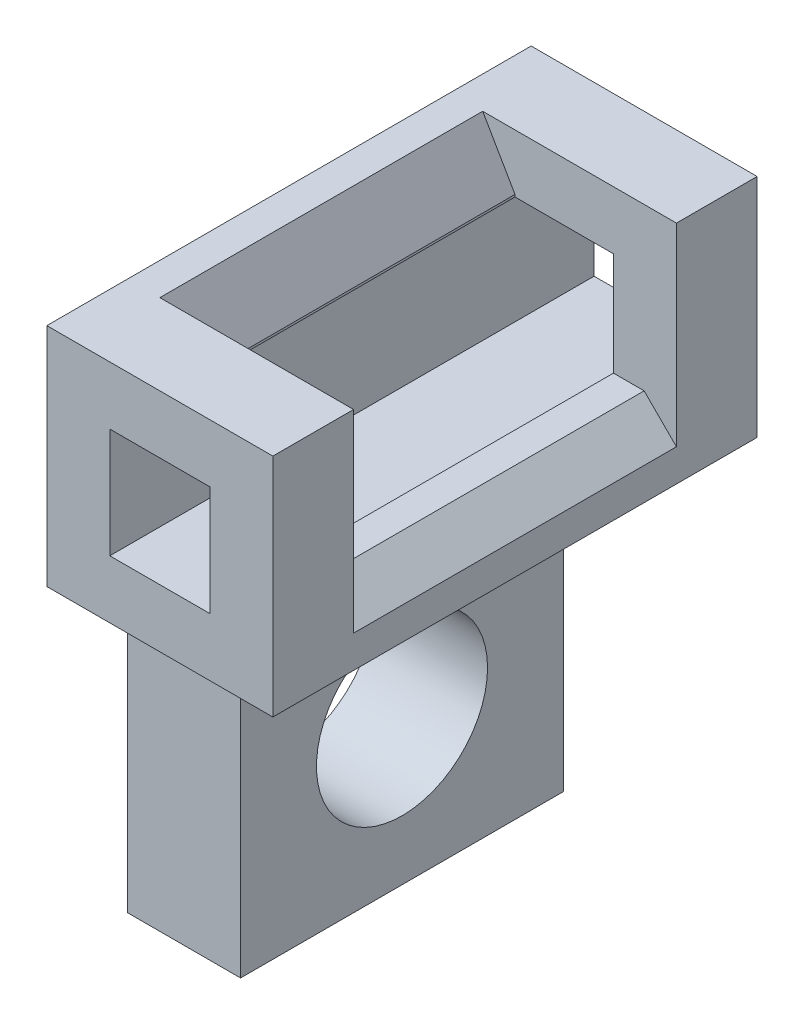
from build123d import *

# Parameters (mm, degrees)
SKIZZE1_W                       = 7
SKIZZE1_H                       = 7
AUFSATZ_LINEAR_AUSTRAGEN1_DEPTH = 15
SKIZZE2_W                       = 3.1
SKIZZE2_H                       = 3.4
SCHNITT_LINEAR_AUSTRAGEN1_DEPTH = 16.795568999
SKIZZE3_W                       = 5
SKIZZE3_H                       = 10
SCHNITT_LINEAR_AUSTRAGEN2_DEPTH = 5
FASE2_SIZE                      = 1
FASE2_SIZE2                     = 1.732050808
SKIZZE5_W                       = 3.5
SKIZZE5_H                       = 10
AUFSATZ_LINEAR_AUSTRAGEN2_DEPTH = 10
FASE3_SIZE                      = 1
SKIZZE6_R                       = 2.65
SCHNITT_LINEAR_AUSTRAGEN3_DEPTH = 10
FASE4_SIZE                      = 1


with BuildPart() as part:
    # Skizze1 → Aufsatz-Linear austragen1 (new body)
    with BuildSketch(Plane.XY):
        Rectangle(SKIZZE1_W, SKIZZE1_H)
    extrude(amount=AUFSATZ_LINEAR_AUSTRAGEN1_DEPTH)

    # Skizze2 → Schnitt-Linear austragen1 (cut, through all)
    with BuildSketch(Plane.XY.offset(15)):
        Rectangle(SKIZZE2_W, SKIZZE2_H)
    extrude(amount=-SCHNITT_LINEAR_AUSTRAGEN1_DEPTH, mode=Mode.SUBTRACT)

    # Skizze3 → Schnitt-Linear austragen2 (cut)
    with BuildSketch(Plane(origin=(0, 3.5, 0), x_dir=(1, 0, 0), z_dir=(0, 1, 0))):
        with Locations((1, -7.5)):
            Rectangle(SKIZZE3_W, SKIZZE3_H)
    extrude(amount=-SCHNITT_LINEAR_AUSTRAGEN2_DEPTH, mode=Mode.SUBTRACT)

    # Fase2
    fase2_edges = [part.edges().sort_by_distance(p)[0] for p in [
        (-1.5, 3.5, 7.5),
    ]]
    fase2_side = [part.faces().sort_by_distance(p)[0] for p in [
        (0, 3.5, 0.165529454),
    ]]
    chamfer(fase2_edges, length=FASE2_SIZE, length2=FASE2_SIZE2, reference=fase2_side[0])

    # Skizze5 → Aufsatz-Linear austragen2 (add)
    with BuildSketch(Plane.XZ.offset(3.5)):
        with Locations((-1.75, 7.5)):
            Rectangle(SKIZZE5_W, SKIZZE5_H)
    extrude(amount=AUFSATZ_LINEAR_AUSTRAGEN2_DEPTH)

    # Fase3
    fase3_edges = [part.edges().sort_by_distance(p)[0] for p in [
        (-1.75, -3.5, 2.5),
        (0, -3.5, 7.5),
        (-1.75, -3.5, 12.5),
    ]]
    chamfer(fase3_edges, length=FASE3_SIZE)

    # Skizze6 → Schnitt-Linear austragen3 (cut)
    with BuildSketch(Plane(origin=(0, 0, 0), x_dir=(0, 0, -1), z_dir=(1, 0, 0))):
        with Locations((-7.5, -9)):
            Circle(SKIZZE6_R)
    extrude(amount=-SCHNITT_LINEAR_AUSTRAGEN3_DEPTH, mode=Mode.SUBTRACT)

    # Fase4
    fase4_edges = [part.edges().sort_by_distance(p)[0] for p in [
        (3.5, -1.5, 7.5),
    ]]
    chamfer(fase4_edges, length=FASE4_SIZE)


solid = part.part
